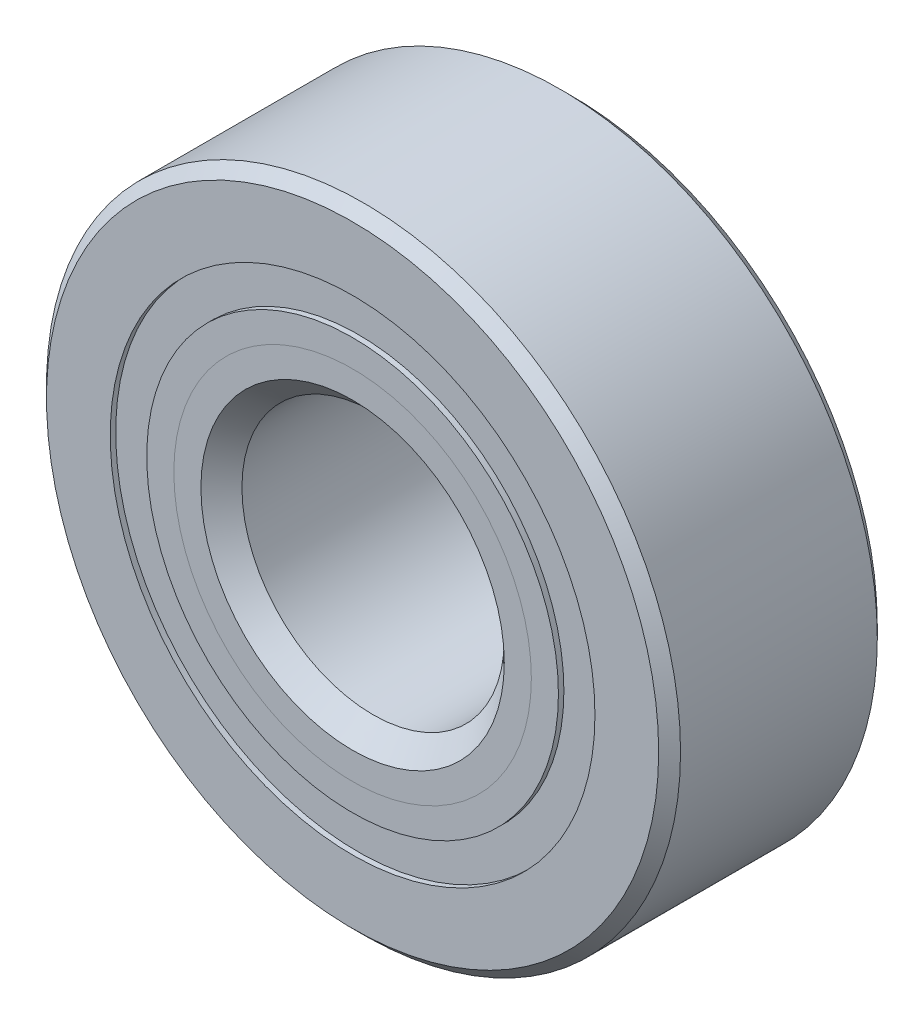
from build123d import *

# Parameters (mm, degrees)
CIRPATTERN1_COUNT = 12
SKETCH5_W         = 1.885967402
SKETCH5_H         = 1.325824176


with BuildPart() as part:
    # Sketch1 → Revolve1 (revolve)
    with BuildSketch(Plane(origin=(0, 0, 0), x_dir=(0, 0, -1), z_dir=(1, 0, 0)), mode=Mode.PRIVATE) as revolve1_sk:
        with BuildLine():
            Line((3.571875, 11.509375), (-3.571875, 11.509375))
            Line((-3.571875, 11.509375), (-3.96875, 11.1125))
            Line((-3.96875, 11.1125), (-3.96875, 8.798849588))
            Line((-3.96875, 8.798849588), (-1.763888889, 8.798849588))
            ThreePointArc((-1.763888889, 8.798849588), (0, 10.020282598), (1.763888889, 8.798849588))
            Line((1.763888889, 8.798849588), (3.96875, 8.798849588))
            Line((3.96875, 8.798849588), (3.96875, 11.1125))
            Line((3.96875, 11.1125), (3.571875, 11.509375))
        make_face()
    revolve(revolve1_sk.sketch.rotate(Axis((0, 0, 3.96875), (0, 0, -1)), 90), axis=Axis((0, 0, 3.96875), (0, 0, -1)))


with BuildPart() as body_2:
    # Sketch2 → Revolve2 (revolve)
    with BuildSketch(Plane(origin=(0, 0, 0), x_dir=(0, 0, -1), z_dir=(1, 0, 0)), mode=Mode.PRIVATE) as revolve2_sk:
        with BuildLine():
            Line((-3.96875, 7.473025412), (-1.763888889, 7.473025412))
            ThreePointArc((-1.763888889, 7.473025412), (-1.072753771, 6.586758428), (0, 6.251592402))
            Line((0, 6.251592402), (0, 5.507046201))
            Line((0, 5.507046201), (-2.985760394, 5.507046201))
            Line((-2.985760394, 5.507046201), (-3.96875, 6.490035807))
            Line((-3.96875, 6.490035807), (-3.96875, 7.473025412))
        make_face()
    revolve(revolve2_sk.sketch.rotate(Axis((0, 0, 3.96875), (0, 0, -1)), 90), axis=Axis((0, 0, 3.96875), (0, 0, -1)))


with BuildPart() as body_3:
    # Sketch3 → Revolve3 (revolve)
    with BuildSketch(Plane(origin=(0, 0, 0), x_dir=(0, 0, -1), z_dir=(1, 0, 0)), mode=Mode.PRIVATE) as revolve3_sk:
        with BuildLine():
            Line((-3.96875, 6.490035807), (-2.985760394, 5.507046201))
            Line((-2.985760394, 5.507046201), (0, 5.507046201))
            Line((0, 5.507046201), (0, 6.251592402))
            ThreePointArc((0, 6.251592402), (1.072753771, 6.586758428), (1.763888889, 7.473025412))
            Line((1.763888889, 7.473025412), (3.96875, 7.473025412))
            Line((3.96875, 7.473025412), (3.96875, 5.159375))
            Line((3.96875, 5.159375), (3.571875, 4.7625))
            Line((3.571875, 4.7625), (-3.224203799, 4.7625))
            Line((-3.224203799, 4.7625), (-3.96875, 5.507046201))
            Line((-3.96875, 5.507046201), (-3.96875, 6.490035807))
        make_face()
    revolve(revolve3_sk.sketch.rotate(Axis((0, 0, 3.96875), (0, 0, -1)), 90), axis=Axis((0, 0, 3.96875), (0, 0, -1)))


with BuildPart() as body_4:
    # Sketch4 → Revolve4 (revolve)
    with BuildSketch(Plane(origin=(0, 0, 0), x_dir=(0, 0, -1), z_dir=(1, 0, 0))):
        with BuildLine():
            Line((-1.884345098, 8.1359375), (1.884345098, 8.1359375))
            ThreePointArc((1.884345098, 8.1359375), (0, 10.020282598), (-1.884345098, 8.1359375))
        make_face()
    revolve(axis=Axis((0, 8.1359375, 1.884345098), (0, 0, -1)))


with BuildPart() as cirpattern1_1:
    # CirPattern1: pattern copy
    add(body_4.part.rotate(Axis((0, 0, 0), (0, 0, 1)), 1 * 360 / CIRPATTERN1_COUNT))


with BuildPart() as cirpattern1_2:
    # CirPattern1: pattern copy
    add(body_4.part.rotate(Axis((0, 0, 0), (0, 0, 1)), 2 * 360 / CIRPATTERN1_COUNT))


with BuildPart() as cirpattern1_3:
    # CirPattern1: pattern copy
    add(body_4.part.rotate(Axis((0, 0, 0), (0, 0, 1)), 3 * 360 / CIRPATTERN1_COUNT))


with BuildPart() as cirpattern1_4:
    # CirPattern1: pattern copy
    add(body_4.part.rotate(Axis((0, 0, 0), (0, 0, 1)), 4 * 360 / CIRPATTERN1_COUNT))


with BuildPart() as cirpattern1_5:
    # CirPattern1: pattern copy
    add(body_4.part.rotate(Axis((0, 0, 0), (0, 0, 1)), 5 * 360 / CIRPATTERN1_COUNT))


with BuildPart() as cirpattern1_6:
    # CirPattern1: pattern copy
    add(body_4.part.rotate(Axis((0, 0, 0), (0, 0, 1)), 6 * 360 / CIRPATTERN1_COUNT))


with BuildPart() as cirpattern1_7:
    # CirPattern1: pattern copy
    add(body_4.part.rotate(Axis((0, 0, 0), (0, 0, 1)), 7 * 360 / CIRPATTERN1_COUNT))


with BuildPart() as cirpattern1_8:
    # CirPattern1: pattern copy
    add(body_4.part.rotate(Axis((0, 0, 0), (0, 0, 1)), 8 * 360 / CIRPATTERN1_COUNT))


with BuildPart() as cirpattern1_9:
    # CirPattern1: pattern copy
    add(body_4.part.rotate(Axis((0, 0, 0), (0, 0, 1)), 9 * 360 / CIRPATTERN1_COUNT))


with BuildPart() as cirpattern1_10:
    # CirPattern1: pattern copy
    add(body_4.part.rotate(Axis((0, 0, 0), (0, 0, 1)), 10 * 360 / CIRPATTERN1_COUNT))


with BuildPart() as cirpattern1_11:
    # CirPattern1: pattern copy
    add(body_4.part.rotate(Axis((0, 0, 0), (0, 0, 1)), 11 * 360 / CIRPATTERN1_COUNT))


with BuildPart() as body_16:
    # Sketch5 → Revolve5 (revolve)
    with BuildSketch(Plane(origin=(0, 0, 0), x_dir=(0, 0, -1), z_dir=(1, 0, 0)), mode=Mode.PRIVATE) as revolve5_sk:
        with Locations((-2.827328799, 8.1359375)):
            Rectangle(SKETCH5_W, SKETCH5_H)
        with Locations((2.827328799, 8.1359375)):
            Rectangle(SKETCH5_W, SKETCH5_H)
    revolve(revolve5_sk.sketch.rotate(Axis((0, 0, 3.96875), (0, 0, -1)), 90), axis=Axis((0, 0, 3.96875), (0, 0, -1)))


solid = Compound([part.part, body_2.part, body_3.part, body_4.part, cirpattern1_1.part, cirpattern1_2.part, cirpattern1_3.part, cirpattern1_4.part, cirpattern1_5.part, cirpattern1_6.part, cirpattern1_7.part, cirpattern1_8.part, cirpattern1_9.part, cirpattern1_10.part, cirpattern1_11.part, body_16.part])
